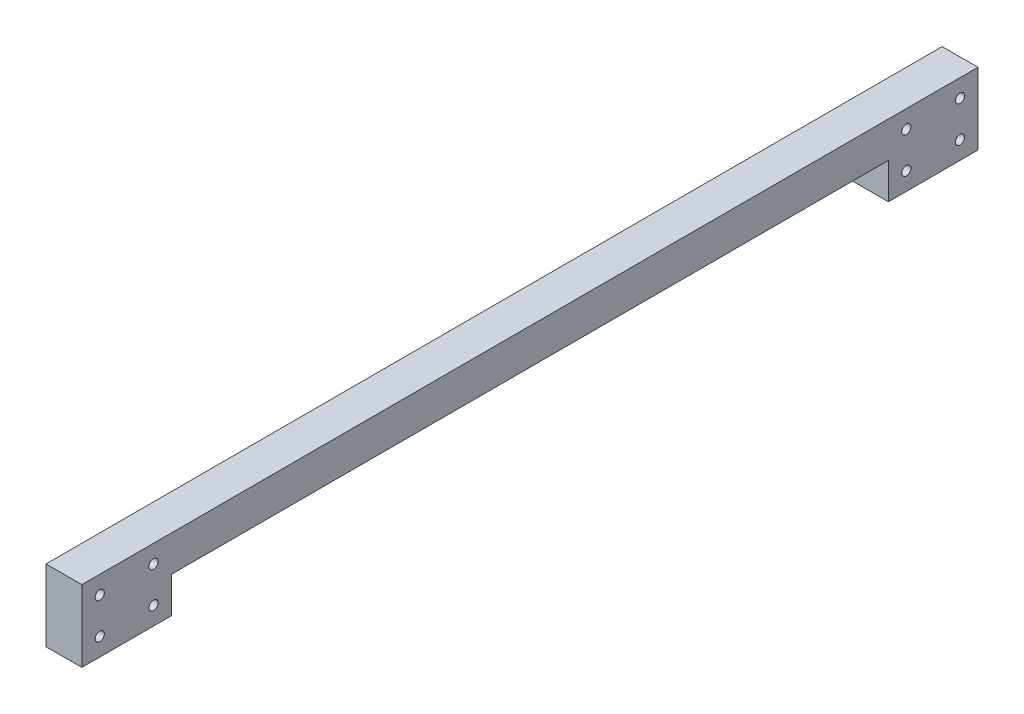
from build123d import *

# Parameters (mm, degrees)
SKETCH_1_W          = 20
SKETCH_1_H          = 20
EXTRUDE_2_DEPTH     = 500
CUT_EXTRUDE_1_REACH = 502.5
SKETCH_2_R          = 2.55
SKETCH_3_W          = 20
SKETCH_3_H          = 50
EXTRUDE_3_DEPTH     = 20
SKETCH_4_R          = 2.55
CUT_EXTRUDE_2_DEPTH = 20
SKETCH_5_W          = 20
SKETCH_5_H          = 20
CUT_EXTRUDE_3_DEPTH = 250
CUT_EXTRUDE_4_REACH = 503.298
SKETCH_6_R          = 2.55


with BuildPart() as part:
    # 草图1 → 凸台-拉伸2 (new body)
    with BuildSketch(Plane.XY):
        Rectangle(SKETCH_1_W, SKETCH_1_H)
    extrude_2 = extrude(amount=EXTRUDE_2_DEPTH)

    # 草图2 → 切除-拉伸1 (cut, up to next)
    with BuildSketch(Plane(origin=(10, 0, 0), x_dir=(0, 0, -1), z_dir=(1, 0, 0)), mode=Mode.PRIVATE) as cut_extrude_1_sk1:
        with Locations((-10, 0)):
            Circle(SKETCH_2_R)
    cut_extrude_1_tool1 = extrude(cut_extrude_1_sk1.sketch, amount=-CUT_EXTRUDE_1_REACH, mode=Mode.PRIVATE) & part.part
    # 草图2 → 切除-拉伸1 (cut, up to next)
    with BuildSketch(Plane(origin=(10, 0, 0), x_dir=(0, 0, -1), z_dir=(1, 0, 0)), mode=Mode.PRIVATE) as cut_extrude_1_sk2:
        with Locations((-40, 0)):
            Circle(SKETCH_2_R)
    cut_extrude_1_tool2 = extrude(cut_extrude_1_sk2.sketch, amount=-CUT_EXTRUDE_1_REACH, mode=Mode.PRIVATE) & part.part
    add(cut_extrude_1_tool1.solids().sort_by_distance((10, 0, 10))[0], mode=Mode.SUBTRACT)
    add(cut_extrude_1_tool2.solids().sort_by_distance((10, 0, 40))[0], mode=Mode.SUBTRACT)

    # 草图3 → 凸台-拉伸3 (add)
    with BuildSketch(Plane.XZ.offset(10)):
        with Locations((0, 25)):
            Rectangle(SKETCH_3_W, SKETCH_3_H)
    extrude_3 = extrude(amount=EXTRUDE_3_DEPTH)

    # 草图4 → 切除-拉伸2 (cut)
    with BuildSketch(Plane(origin=(10, 0, 0), x_dir=(0, 0, -1), z_dir=(1, 0, 0))):
        with Locations((-40, -20)):
            Circle(SKETCH_4_R)
        with Locations((-10, -20)):
            Circle(SKETCH_4_R)
    extrude(amount=-CUT_EXTRUDE_2_DEPTH, mode=Mode.SUBTRACT)

    # 草图5 → 切除-拉伸3 (cut)
    with BuildSketch(Plane.XY.offset(500)):
        Rectangle(SKETCH_5_W, SKETCH_5_H)
    extrude(amount=-CUT_EXTRUDE_3_DEPTH, mode=Mode.SUBTRACT)

    # 镜向2: 凸台-拉伸2, 凸台-拉伸3 across plane
    add(extrude_2.mirror(Plane(origin=(0, 0, 250), x_dir=(1, 0, 0), z_dir=(0, 0, -1))))
    add(extrude_3.mirror(Plane(origin=(0, 0, 250), x_dir=(1, 0, 0), z_dir=(0, 0, -1))))

    # 草图6 → 切除-拉伸4 (cut, up to next)
    with BuildSketch(Plane(origin=(10, 0, 0), x_dir=(0, 0, -1), z_dir=(1, 0, 0)), mode=Mode.PRIVATE) as cut_extrude_4_sk1:
        with Locations((-490, 0)):
            Circle(SKETCH_6_R)
    cut_extrude_4_tool1 = extrude(cut_extrude_4_sk1.sketch, amount=-CUT_EXTRUDE_4_REACH, mode=Mode.PRIVATE) & part.part
    # 草图6 → 切除-拉伸4 (cut, up to next)
    with BuildSketch(Plane(origin=(10, 0, 0), x_dir=(0, 0, -1), z_dir=(1, 0, 0)), mode=Mode.PRIVATE) as cut_extrude_4_sk2:
        with Locations((-460, 0)):
            Circle(SKETCH_6_R)
    cut_extrude_4_tool2 = extrude(cut_extrude_4_sk2.sketch, amount=-CUT_EXTRUDE_4_REACH, mode=Mode.PRIVATE) & part.part
    # 草图6 → 切除-拉伸4 (cut, up to next)
    with BuildSketch(Plane(origin=(10, 0, 0), x_dir=(0, 0, -1), z_dir=(1, 0, 0)), mode=Mode.PRIVATE) as cut_extrude_4_sk3:
        with Locations((-460, -20)):
            Circle(SKETCH_6_R)
    cut_extrude_4_tool3 = extrude(cut_extrude_4_sk3.sketch, amount=-CUT_EXTRUDE_4_REACH, mode=Mode.PRIVATE) & part.part
    # 草图6 → 切除-拉伸4 (cut, up to next)
    with BuildSketch(Plane(origin=(10, 0, 0), x_dir=(0, 0, -1), z_dir=(1, 0, 0)), mode=Mode.PRIVATE) as cut_extrude_4_sk4:
        with Locations((-490, -20)):
            Circle(SKETCH_6_R)
    cut_extrude_4_tool4 = extrude(cut_extrude_4_sk4.sketch, amount=-CUT_EXTRUDE_4_REACH, mode=Mode.PRIVATE) & part.part
    # 草图6 → 切除-拉伸4 (cut, up to next)
    with BuildSketch(Plane(origin=(10, 0, 0), x_dir=(0, 0, -1), z_dir=(1, 0, 0)), mode=Mode.PRIVATE) as cut_extrude_4_sk5:
        with Locations((-10, 0)):
            Circle(SKETCH_6_R)
    cut_extrude_4_tool5 = extrude(cut_extrude_4_sk5.sketch, amount=-CUT_EXTRUDE_4_REACH, mode=Mode.PRIVATE) & part.part
    # 草图6 → 切除-拉伸4 (cut, up to next)
    with BuildSketch(Plane(origin=(10, 0, 0), x_dir=(0, 0, -1), z_dir=(1, 0, 0)), mode=Mode.PRIVATE) as cut_extrude_4_sk6:
        with Locations((-40, 0)):
            Circle(SKETCH_6_R)
    cut_extrude_4_tool6 = extrude(cut_extrude_4_sk6.sketch, amount=-CUT_EXTRUDE_4_REACH, mode=Mode.PRIVATE) & part.part
    add(cut_extrude_4_tool1.solids().sort_by_distance((10, 0, 490))[0], mode=Mode.SUBTRACT)
    add(cut_extrude_4_tool2.solids().sort_by_distance((10, 0, 460))[0], mode=Mode.SUBTRACT)
    add(cut_extrude_4_tool3.solids().sort_by_distance((10, -20, 460))[0], mode=Mode.SUBTRACT)
    add(cut_extrude_4_tool4.solids().sort_by_distance((10, -20, 490))[0], mode=Mode.SUBTRACT)
    add(cut_extrude_4_tool5.solids().sort_by_distance((10, 0, 10))[0], mode=Mode.SUBTRACT)
    add(cut_extrude_4_tool6.solids().sort_by_distance((10, 0, 40))[0], mode=Mode.SUBTRACT)


solid = part.part
